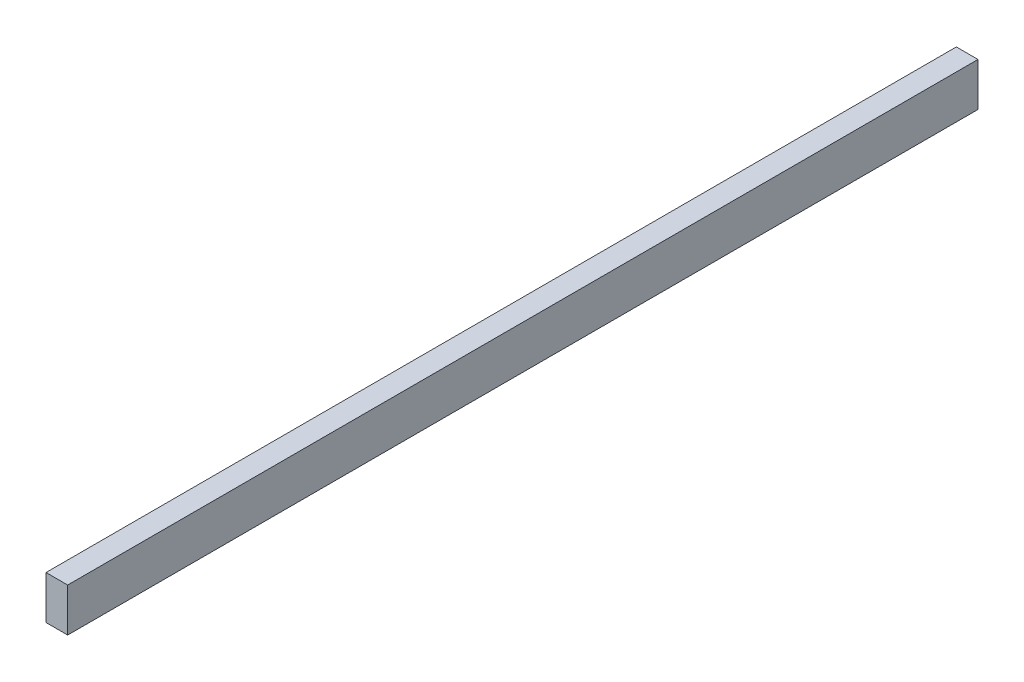
from build123d import *

# Parameters (mm, degrees)
SKETCH1_W           = 50.8
SKETCH1_H           = 101.6
BOSS_EXTRUDE1_DEPTH = 2133.6


with BuildPart() as part:
    # Sketch1 → Boss-Extrude1 (new body)
    with BuildSketch(Plane.XY):
        Rectangle(SKETCH1_W, SKETCH1_H)
    extrude(amount=BOSS_EXTRUDE1_DEPTH)


solid = part.part
